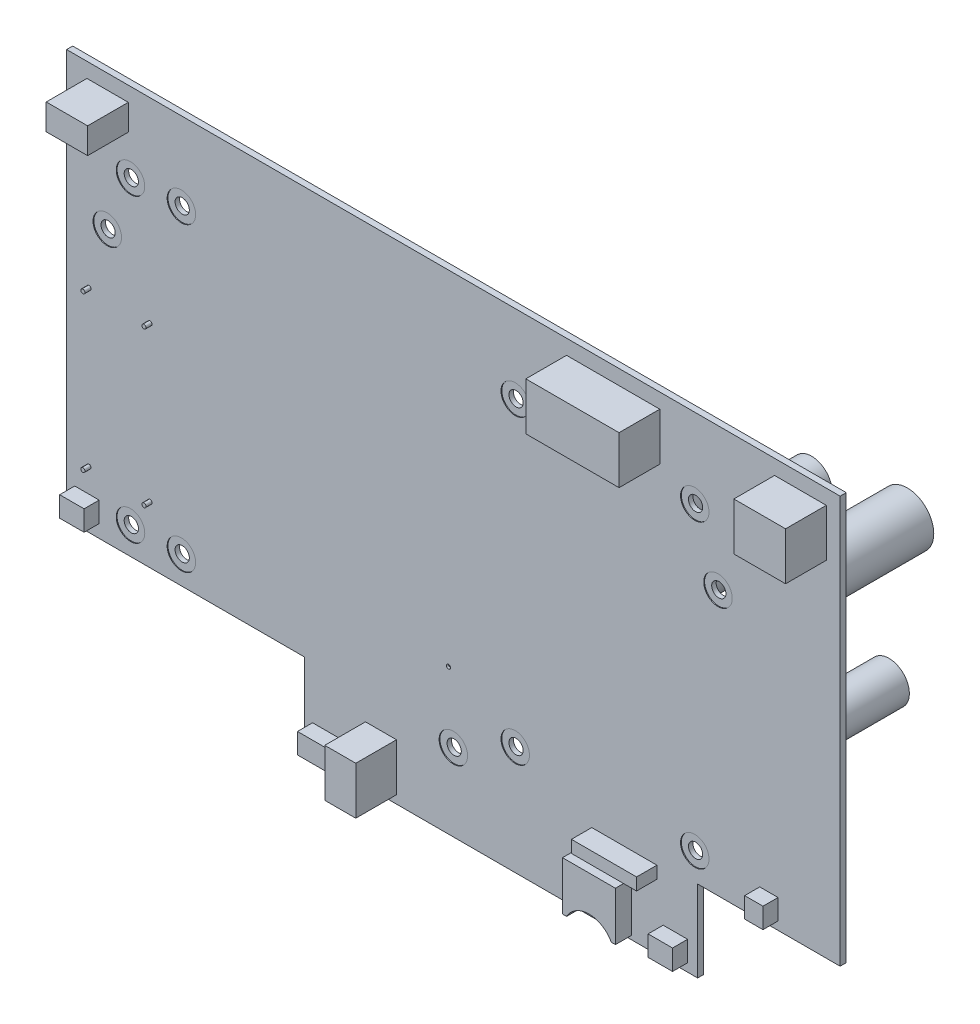
from build123d import *

# Parameters (mm, degrees)
BASE_EXTRUSION_DEPTH     = 1.5
ESQUISSE2_R              = 1.75
ENL_V_MAT_EXTRU_1_DEPTH  = 2
ESQUISSE5_R              = 1.75
ENL_V_MAT_EXTRU_2_DEPTH  = 3
ESQUISSE6_R              = 1.75
ENL_V_MAT_EXTRU_3_DEPTH  = 2
ESQUISSE7_R              = 7.75
BOSS_EXTRU_1_DEPTH       = 14.5
ESQUISSE10_R             = 0.5
ENL_V_MAT_EXTRU_4_DEPTH  = 0.5
ESQUISSE11_W             = 10.16
ESQUISSE11_H             = 6.35
ESQUISSE11_W_2           = 22.9
ESQUISSE11_H_2           = 11.7
ESQUISSE11_W_3           = 12.7
ESQUISSE11_W_4           = 7.62
BOSS_EXTRU_3_DEPTH       = 10
ESQUISSE12_W             = 20
ESQUISSE12_H             = 42
BOSS_EXTRU_4_DEPTH       = 12
ESQUISSE13_W             = 20
ESQUISSE13_H             = 10
ENL_V_MAT_EXTRU_5_DEPTH  = 2
ESQUISSE14_W             = 4.5
ESQUISSE14_H             = 5
ESQUISSE14_W_2           = 6
ESQUISSE14_W_3           = 7.5
BOSS_EXTRU_5_DEPTH       = 3.7
BOSS_EXTRU_6_DEPTH       = 4
ESQUISSE16_W             = 16
ESQUISSE16_H             = 3
BOSS_EXTRU_7_DEPTH       = 5
ESQUISSE17_R             = 8
ENL_V_MAT_EXTRU_6_DEPTH  = 0.2
ESQUISSE18_R             = 3.5
ENL_V_MAT_EXTRU_7_DEPTH  = 0.2
ENL_V_START              = -0.2
ESQUISSE19_R             = 3.5
ENL_V_MAT_EXTRU_8_DEPTH  = 0.2
ESQUISSE21_R             = 6.5
EXTRUSION1_DEPTH         = 30
ESQUISSE22_R             = 5
EXTRUSION2_DEPTH         = 13
ESQUISSE23_R             = 5
EXTRUSION3_DEPTH         = 16.5
ESQUISSE24_R             = 10.5
EXTRUSION4_DEPTH         = 7.5
ENL_V_START_2            = -20
ESQUISSE25_W             = 2
ESQUISSE25_H             = 42
ENL_V_MAT_EXTRU_9_DEPTH  = 20
ESQUISSE26_W             = 1
ESQUISSE26_H             = 42
ENL_V_MAT_EXTRU_10_DEPTH = 20
ESQUISSE27_R             = 0.5
EXTRUSION5_DEPTH         = 5.8
ESQUISSE28_R             = 0.3
EXTRUSION6_DEPTH         = 2.8


with BuildPart() as part:
    # Esquisse1 → Base-Extrusion (new body)
    with BuildSketch(Plane.XY):
        Polygon((87.14228109, -46.913176144), (87.14228109, -26.913176144), (122.14228109, -26.913176144), (122.14228109, 73.086823856), (-67.85771891, 73.086823856), (-67.85771891, -26.913176144), (-9.445816536, -26.913176144), (-9.445816536, -46.913176144), align=None)
    extrude(amount=BASE_EXTRUSION_DEPTH)

    # Esquisse2 → Enlèv. mat.-Extru.1 (cut)
    with BuildSketch(Plane(origin=(0, 0, 0), x_dir=(-1, 0, 0), z_dir=(0, 0, -1))):
        with Locations((-86.44228109, 53.586823856)):
            Circle(ESQUISSE2_R)
        with Locations((52.15771891, 53.586823856)):
            Circle(ESQUISSE2_R)
        with Locations((52.15771891, -20.213176144)):
            Circle(ESQUISSE2_R)
        with Locations((-86.44228109, -20.213176144)):
            Circle(ESQUISSE2_R)
    extrude(amount=-ENL_V_MAT_EXTRU_1_DEPTH, mode=Mode.SUBTRACT)

    # Esquisse5 → Enlèv. mat.-Extru.2 (cut)
    with BuildSketch(Plane.XY.offset(1.5)):
        with Locations((92.14228109, 38.086823856)):
            Circle(ESQUISSE5_R)
        with Locations((-57.85771891, 39.836823856)):
            Circle(ESQUISSE5_R)
        with Locations((27.14228109, -27.913176144)):
            Circle(ESQUISSE5_R)
    extrude(amount=-ENL_V_MAT_EXTRU_2_DEPTH, mode=Mode.SUBTRACT)

    # Esquisse6 → Enlèv. mat.-Extru.3 (cut)
    with BuildSketch(Plane(origin=(0, 0, 0), x_dir=(-1, 0, 0), z_dir=(0, 0, -1))):
        with Locations((-42.34228109, 53.814120893)):
            Circle(ESQUISSE6_R)
        with Locations((39.65771891, 53.814120893)):
            Circle(ESQUISSE6_R)
        with Locations((39.65771891, -20.185879107)):
            Circle(ESQUISSE6_R)
        with Locations((-42.34228109, -20.185879107)):
            Circle(ESQUISSE6_R)
    extrude(amount=-ENL_V_MAT_EXTRU_3_DEPTH, mode=Mode.SUBTRACT)

    # Esquisse7 → Boss.-Extru.1 (add)
    with BuildSketch(Plane(origin=(0, 0, 0), x_dir=(-1, 0, 0), z_dir=(0, 0, -1))):
        with Locations(Location((-73.14228109, 46.086823856, 0), (0, 0, 180))):
            Circle(ESQUISSE7_R)
        with Locations(Location((-73.14228109, 29.086823856, 0), (0, 0, 180))):
            Circle(ESQUISSE7_R)
    extrude(amount=BOSS_EXTRU_1_DEPTH)

    # Esquisse10 → Enlèv. mat.-Extru.4 (cut)
    with BuildSketch(Plane.XY.offset(1.5)):
        with Locations((25.94228109, -11.285879107)):
            Circle(ESQUISSE10_R)
    extrude(amount=-ENL_V_MAT_EXTRU_4_DEPTH, mode=Mode.SUBTRACT)

    # Esquisse11 → Boss.-Extru.3 (add)
    with BuildSketch(Plane.XY.offset(1.5)):
        with Locations((-57.77771891, 66.261823856)):
            Rectangle(ESQUISSE11_W, ESQUISSE11_H)
        with Locations((66.39228109, 63.586823856)):
            Rectangle(ESQUISSE11_W_2, ESQUISSE11_H_2)
        with Locations((112.39228109, 63.586823856)):
            Rectangle(ESQUISSE11_W_3, ESQUISSE11_H_2)
        with Locations((9.364183464, -39.063176144)):
            Rectangle(ESQUISSE11_W_4, ESQUISSE11_H_2)
    extrude(amount=BOSS_EXTRU_3_DEPTH)

    # Esquisse12 → Boss.-Extru.4 (add)
    with BuildSketch(Plane(origin=(0, 0, 0), x_dir=(-1, 0, 0), z_dir=(0, 0, -1))):
        with Locations((54.85771891, 6.145794296)):
            Rectangle(ESQUISSE12_W, ESQUISSE12_H)
    extrude(amount=BOSS_EXTRU_4_DEPTH)

    # Esquisse13 → Enlèv. mat.-Extru.5 (cut)
    with BuildSketch(Plane(origin=(0, 0, -12), x_dir=(-1, 0, 0), z_dir=(0, 0, -1))):
        with Locations((54.85771891, 22.145794296)):
            Rectangle(ESQUISSE13_W, ESQUISSE13_H)
    extrude(amount=-ENL_V_MAT_EXTRU_5_DEPTH, mode=Mode.SUBTRACT)

    # Esquisse14 → Boss.-Extru.5 (add)
    with BuildSketch(Plane.XY.offset(1.5)):
        with Locations((104.64228109, -22.413176144)):
            Rectangle(ESQUISSE14_W, ESQUISSE14_H)
        with Locations((81.674183464, -42.413176144)):
            Rectangle(ESQUISSE14_W_2, ESQUISSE14_H)
        with Locations((-3.695816536, -42.413176144)):
            Rectangle(ESQUISSE14_W_3, ESQUISSE14_H)
        with Locations((-62.85771891, -21.257041072)):
            Rectangle(ESQUISSE14_W_2, ESQUISSE14_H)
    extrude(amount=BOSS_EXTRU_5_DEPTH)

    # Esquisse15 → Boss.-Extru.6 (add)
    with BuildSketch(Plane.XY.offset(1.5)):
        with BuildLine():
            Line((57.951375039, -45.913176144), (58.951375039, -45.913176144))
            ThreePointArc((58.951375039, -45.913176144), (64.451375039, -42.64766465), (69.951375039, -45.913176144))
            Line((69.951375039, -45.913176144), (70.951375039, -45.913176144))
            Line((70.951375039, -45.913176144), (70.951375039, -33.913176144))
            Line((70.951375039, -33.913176144), (57.951375039, -33.913176144))
            Line((57.951375039, -33.913176144), (57.951375039, -45.913176144))
        make_face()
    extrude(amount=BOSS_EXTRU_6_DEPTH)

    # Esquisse16 → Boss.-Extru.7 (add)
    with BuildSketch(Plane.XY.offset(1.5)):
        with Locations((69.14228109, -29.413176144)):
            Rectangle(ESQUISSE16_W, ESQUISSE16_H)
    extrude(amount=BOSS_EXTRU_7_DEPTH)

    # Esquisse17 → Enlèv. mat.-Extru.6 (cut)
    with BuildSketch(Plane(origin=(0, 0, 0), x_dir=(-1, 0, 0), z_dir=(0, 0, -1))):
        with Locations((-27.14228109, -24.413176144)):
            Circle(ESQUISSE17_R)
        with Locations((-92.14228109, 41.586823856)):
            Circle(ESQUISSE17_R)
        with Locations((57.85771891, 43.336823856)):
            Circle(ESQUISSE17_R)
    extrude(amount=-ENL_V_MAT_EXTRU_6_DEPTH, mode=Mode.SUBTRACT)

    # Esquisse18 → Enlèv. mat.-Extru.7 (cut)
    with BuildSketch(Plane(origin=(0, 0, 0), x_dir=(-1, 0, 0), z_dir=(0, 0, -1))):
        with Locations((-86.44228109, 53.586823856)):
            Circle(ESQUISSE18_R)
        with Locations((-42.34228109, 53.814120893)):
            Circle(ESQUISSE18_R)
        with Locations((39.65771891, 53.814120893)):
            Circle(ESQUISSE18_R)
        with Locations((52.15771891, 53.586823856)):
            Circle(ESQUISSE18_R)
        with Locations((52.15771891, -20.213176144)):
            Circle(ESQUISSE18_R)
        with Locations((39.65771891, -20.185879107)):
            Circle(ESQUISSE18_R)
        with Locations((-42.34228109, -20.185879107)):
            Circle(ESQUISSE18_R)
        with Locations((-86.44228109, -20.213176144)):
            Circle(ESQUISSE18_R)
    extrude(amount=-ENL_V_MAT_EXTRU_7_DEPTH, mode=Mode.SUBTRACT)

    # Esquisse19 → Enlèv. mat.-Extru.8 (cut)
    with BuildSketch(Plane.XY.offset(1.5).offset(ENL_V_START)):
        with Locations(Location((-52.15771891, 53.586823856, 0), (0, 0, 180))):
            Circle(ESQUISSE19_R)
        with Locations(Location((-39.65771891, 53.814120893, 0), (0, 0, 180))):
            Circle(ESQUISSE19_R)
        with Locations(Location((42.34228109, 53.814120893, 0), (0, 0, 180))):
            Circle(ESQUISSE19_R)
        with Locations(Location((86.44228109, 53.586823856, 0), (0, 0, 180))):
            Circle(ESQUISSE19_R)
        with Locations((92.14228109, 38.086823856)):
            Circle(ESQUISSE19_R)
        with Locations(Location((86.44228109, -20.213176144, 0), (0, 0, 180))):
            Circle(ESQUISSE19_R)
        with Locations(Location((42.34228109, -20.185879107, 0), (0, 0, 180))):
            Circle(ESQUISSE19_R)
        with Locations((27.14228109, -27.913176144)):
            Circle(ESQUISSE19_R)
        with Locations(Location((-39.65771891, -20.185879107, 0), (0, 0, 180))):
            Circle(ESQUISSE19_R)
        with Locations(Location((-52.15771891, -20.213176144, 0), (0, 0, 180))):
            Circle(ESQUISSE19_R)
        with Locations((-57.85771891, 39.836823856)):
            Circle(ESQUISSE19_R)
    extrude(amount=ENL_V_MAT_EXTRU_8_DEPTH, mode=Mode.SUBTRACT)

    # Esquisse21 → Extrusion1 (add)
    with BuildSketch(Plane(origin=(0, 0, 0), x_dir=(-1, 0, 0), z_dir=(0, 0, -1))):
        with Locations(Location((-107.14228109, 45.086823856, 0), (0, 0, 180))):
            Circle(ESQUISSE21_R)
    extrude(amount=EXTRUSION1_DEPTH)

    # Esquisse22 → Extrusion2 (add)
    with BuildSketch(Plane(origin=(0, 0, 0), x_dir=(-1, 0, 0), z_dir=(0, 0, -1))):
        with Locations(Location((-100.64228109, 58.586823856, 0), (0, 0, 180))):
            Circle(ESQUISSE22_R)
    extrude(amount=EXTRUSION2_DEPTH)

    # Esquisse23 → Extrusion3 (add)
    with BuildSketch(Plane(origin=(0, 0, 0), x_dir=(-1, 0, 0), z_dir=(0, 0, -1))):
        with Locations(Location((-116.14228109, 21.586823856, 0), (0, 0, 180))):
            Circle(ESQUISSE23_R)
    extrude(amount=EXTRUSION3_DEPTH)

    # Esquisse24 → Extrusion4 (add)
    with BuildSketch(Plane(origin=(0, 0, 0), x_dir=(-1, 0, 0), z_dir=(0, 0, -1))):
        with Locations(Location((-93.14228109, 18.086823856, 0), (0, 0, 180))):
            Circle(ESQUISSE24_R)
    extrude(amount=EXTRUSION4_DEPTH)

    # Esquisse25 → Enlèv. mat.-Extru.9 (cut)
    with BuildSketch(Plane.ZY.offset(64.85771891).offset(ENL_V_START_2)):
        with Locations((-1, 6.145794296)):
            Rectangle(ESQUISSE25_W, ESQUISSE25_H)
    extrude(amount=ENL_V_MAT_EXTRU_9_DEPTH, mode=Mode.SUBTRACT)


with BuildPart() as enl_v_mat_extru_9_piece_1:
    # of the separate pieces the step leaves, piece 1, a body of its own (enl_v_mat_extru_9_pieces)
    add(part.part.solids().sort_by_distance((87.14228109, -46.913176144, 0))[0])



with BuildPart() as enl_v_mat_extru_9_piece_2:
    # of the separate pieces the step leaves, piece 2, a body of its own (enl_v_mat_extru_9_pieces)
    add(part.part.solids().sort_by_distance((-64.85771891, 27.145794296, -2))[0])

    # Esquisse26 → Enlèv. mat.-Extru.10 (cut)
    with BuildSketch(Plane.ZY.offset(64.85771891).offset(ENL_V_START_2)):
        with Locations((-3.3, 6.145794296)):
            Rectangle(ESQUISSE26_W, ESQUISSE26_H)
    extrude(amount=ENL_V_MAT_EXTRU_10_DEPTH, mode=Mode.SUBTRACT)


with BuildPart() as enl_v_mat_extru_10_piece_1:
    # of the separate pieces the step leaves, piece 1, a body of its own (enl_v_mat_extru_10_pieces)
    add(enl_v_mat_extru_9_piece_2.part.solids().sort_by_distance((-64.85771891, 27.145794296, -3.8))[0])


with BuildPart() as enl_v_mat_extru_10_piece_2:
    # of the separate pieces the step leaves, piece 2, a body of its own (enl_v_mat_extru_10_pieces)
    add(enl_v_mat_extru_9_piece_2.part.solids().sort_by_distance((-64.85771891, 27.145794296, -2))[0])


with BuildPart() as enl_v_mat_extru_9_piece_1_1:
    add(enl_v_mat_extru_9_piece_1.part)

    add(enl_v_mat_extru_10_piece_2.part)  # Extrusion5 merges Enlèv. mat.-Extru.10 piece 2
    # Esquisse27 → Extrusion5 (add)
    with BuildSketch(Plane(origin=(0, 0, -2.8), x_dir=(-1, 0, 0), z_dir=(0, 0, -1))):
        with Locations(Location((47.35771891, 25.145794296, 0), (0, 0, 90))):
            Circle(ESQUISSE27_R)
        with Locations(Location((62.35771891, 25.145794296, 0), (0, 0, 90))):
            Circle(ESQUISSE27_R)
        with Locations(Location((62.35771891, -12.854205704, 0), (0, 0, 90))):
            Circle(ESQUISSE27_R)
        with Locations(Location((47.35771891, -12.854205704, 0), (0, 0, 90))):
            Circle(ESQUISSE27_R)
    extrude(amount=-EXTRUSION5_DEPTH)


    add(enl_v_mat_extru_10_piece_1.part)  # Extrusion6 merges Enlèv. mat.-Extru.10 piece 1
    # Esquisse28 → Extrusion6 (add)
    with BuildSketch(Plane.XY.offset(-3.8)):
        with Locations(Location((-59.85771891, 11.652629961, 0), (0, 0, 90))):
            Circle(ESQUISSE28_R)
        with Locations(Location((-59.85771891, 1.652629961, 0), (0, 0, 90))):
            Circle(ESQUISSE28_R)
        with Locations(Location((-49.85771891, 1.652629961, 0), (0, 0, 90))):
            Circle(ESQUISSE28_R)
        with Locations(Location((-49.85771891, 11.652629961, 0), (0, 0, 90))):
            Circle(ESQUISSE28_R)
        with Locations(Location((-59.904799785, -5.17745134, 0), (0, 0, 90))):
            Circle(ESQUISSE28_R)
        with Locations(Location((-59.904799785, -7.17745134, 0), (0, 0, 90))):
            Circle(ESQUISSE28_R)
        with Locations(Location((-59.904799785, -9.17745134, 0), (0, 0, 90))):
            Circle(ESQUISSE28_R)
        with Locations(Location((-52.228118395, 22.117340972, 0), (0, 0, 90))):
            Circle(ESQUISSE28_R)
        with Locations(Location((-52.228118395, 19.406334461, 0), (0, 0, 90))):
            Circle(ESQUISSE28_R)
        with Locations(Location((-57.487319424, 19.406334461, 0), (0, 0, 90))):
            Circle(ESQUISSE28_R)
        with Locations(Location((-57.487319424, 22.117340972, 0), (0, 0, 90))):
            Circle(ESQUISSE28_R)
    extrude(amount=EXTRUSION6_DEPTH)


solid = enl_v_mat_extru_9_piece_1_1.part
